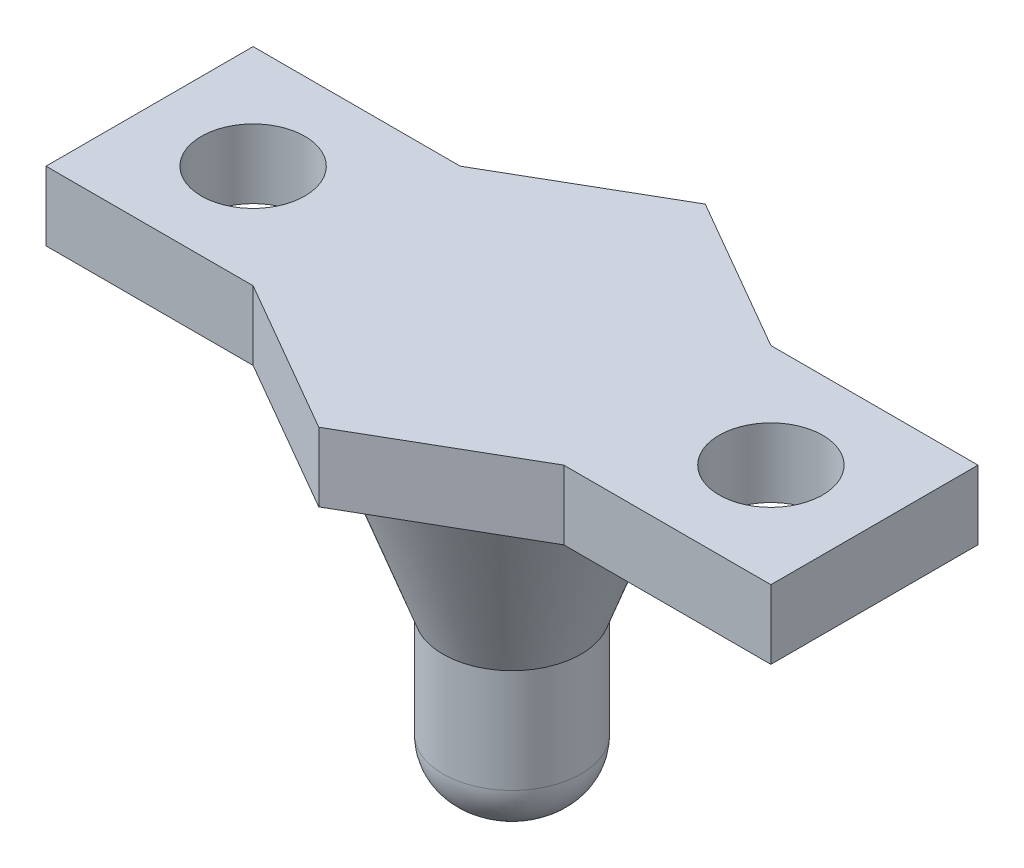
from build123d import *

# Parameters (mm, degrees)
SKETCH1_R           = 1.5
BOSS_EXTRUDE1_DEPTH = 2


with BuildPart() as part:
    # Sketch1 → Boss-Extrude1 (new body)
    with BuildSketch(Plane(origin=(0, 0, 0), x_dir=(1, 0, 0), z_dir=(0, 1, 0))):
        Polygon((-4.5, 3), (0, 5.598076211), (4.5, 3), (10.5, 3), (10.5, -3), (4.5, -3), (0, -5.598076211), (-4.5, -3), (-10.5, -3), (-10.5, 3), align=None)
        with Locations(Location((-7.5, 0, 0), (0, 0, 270))):
            Circle(SKETCH1_R, mode=Mode.SUBTRACT)
        with Locations(Location((7.5, 0, 0), (0, 0, 90))):
            Circle(SKETCH1_R, mode=Mode.SUBTRACT)
    extrude(amount=BOSS_EXTRUDE1_DEPTH)

    # Sketch2 → Revolve1 (revolve)
    with BuildSketch(Plane.XY, mode=Mode.PRIVATE) as revolve1_sk:
        with BuildLine():
            Line((0, -10), (0.5, -10))
            ThreePointArc((0.5, -10), (1.560660172, -9.560660172), (2, -8.5))
            Line((2, -8.5), (2, 2))
            Line((2, 2), (0, 2))
            Line((0, 2), (0, -10))
        make_face()
        Polygon((4, 0), (2, 0), (2, -5.494954839), align=None)
    revolve(revolve1_sk.sketch.rotate(Axis((0, 2, 0), (0, -1, 0)), 180), axis=Axis((0, 2, 0), (0, -1, 0)))


solid = part.part
